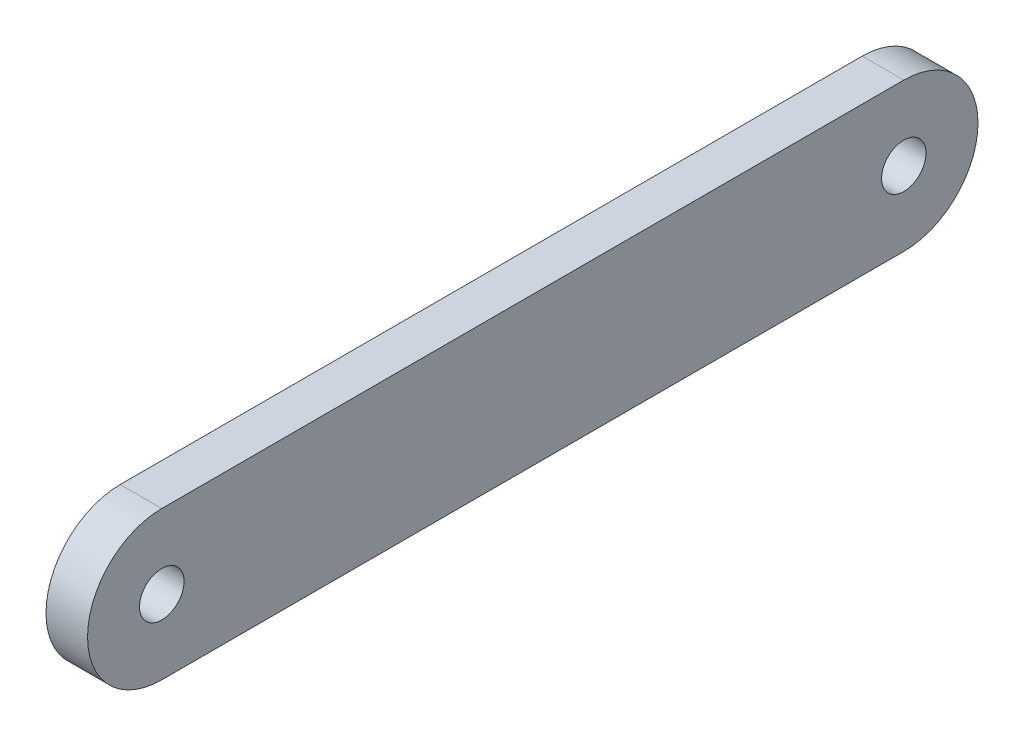
from build123d import *

# Parameters (mm, degrees)
SKETCH_1_R      = 15
EXTRUDE_1_DEPTH = 28


with BuildPart() as part:
    # 草图1 → 凸台-拉伸1 (new body)
    with BuildSketch(Plane(origin=(0, 0, 0), x_dir=(0, 0, -1), z_dir=(1, 0, 0))):
        with BuildLine():
            Line((-250, 50), (250, 50))
            ThreePointArc((250, 50), (300, 0), (250, -50))
            Line((250, -50), (-250, -50))
            ThreePointArc((-250, -50), (-300, 0), (-250, 50))
        make_face()
        with Locations((250, 0)):
            Circle(SKETCH_1_R, mode=Mode.SUBTRACT)
        with Locations((-250, 0)):
            Circle(SKETCH_1_R, mode=Mode.SUBTRACT)
    extrude(amount=EXTRUDE_1_DEPTH)


solid = part.part
